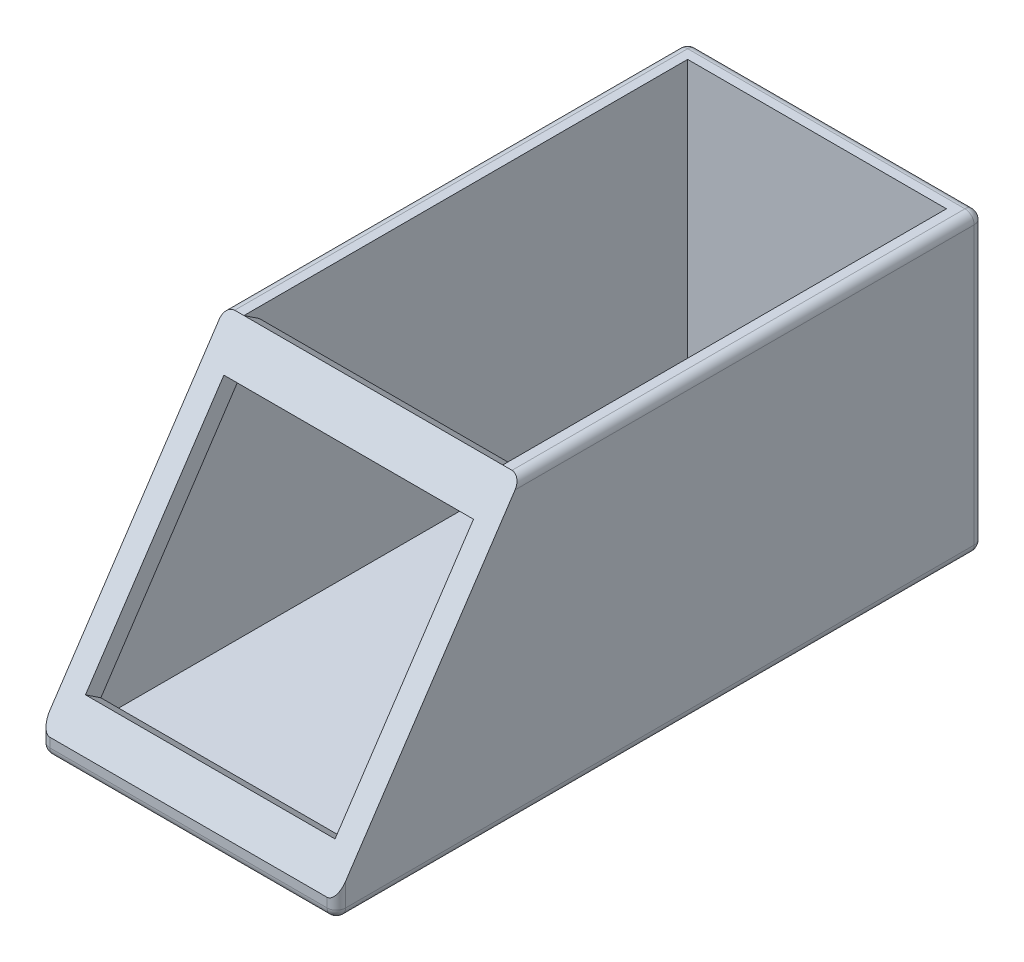
from build123d import *

# Parameters (mm, degrees)
SKETCH2_W           = 32
SKETCH2_H           = 70
BOSS_EXTRUDE1_DEPTH = 2
BOSS_EXTRUDE2_DEPTH = 2
BOSS_EXTRUDE3_DEPTH = 2
SKETCH6_W           = 28
SKETCH6_H           = 30
BOSS_EXTRUDE4_DEPTH = 2
FILLET1_R           = 1
FILLET2_R           = 1
FILLET3_R           = 1
FILLET4_R           = 1
FILLET5_R           = 1
SKETCH7_W           = 28
SKETCH7_H           = 36.055512754
SKETCH7_W_2         = 27
SKETCH7_H_2         = 27
BOSS_EXTRUDE5_DEPTH = 2


with BuildPart() as part:
    # Sketch2 → Boss-Extrude1 (new body)
    with BuildSketch(Plane(origin=(0, 0, 0), x_dir=(1, 0, 0), z_dir=(0, 1, 0))):
        Rectangle(SKETCH2_W, SKETCH2_H)
    extrude(amount=BOSS_EXTRUDE1_DEPTH)



with BuildPart() as body_2:
    # Sketch4 → Boss-Extrude2 (new body)
    with BuildSketch(Plane.ZY.offset(16)):
        Polygon((35, 2), (15, 32), (-35, 32), (-35, 2), align=None)
    extrude(amount=-BOSS_EXTRUDE2_DEPTH)


with BuildPart() as body_3:
    # Sketch5 → Boss-Extrude3 (new body)
    with BuildSketch(Plane(origin=(16, 0, 0), x_dir=(0, 0, -1), z_dir=(1, 0, 0))):
        Polygon((-35, 2), (-15, 32), (35, 32), (35, 2), align=None)
    extrude(amount=-BOSS_EXTRUDE3_DEPTH)


with BuildPart() as part_1:
    add(part.part)

    add(body_2.part)  # Boss-Extrude4 merges body 2

    add(body_3.part)  # Boss-Extrude4 merges body 3
    # Sketch6 → Boss-Extrude4 (add)
    with BuildSketch(Plane(origin=(0, 0, -35), x_dir=(-1, 0, 0), z_dir=(0, 0, -1))):
        with Locations((0, 17)):
            Rectangle(SKETCH6_W, SKETCH6_H)
    extrude(amount=-BOSS_EXTRUDE4_DEPTH)

    # Fillet1
    fillet1_edges = [part_1.edges().sort_by_distance(p)[0] for p in [
        (16, 32, -10),
    ]]
    fillet(fillet1_edges, radius=FILLET1_R)

    # Fillet2
    fillet2_edges = [part_1.edges().sort_by_distance(p)[0] for p in [
        (-16, 32, -10),
    ]]
    fillet(fillet2_edges, radius=FILLET2_R)

    # Fillet3
    fillet3_edges = [part_1.edges().sort_by_distance(p)[0] for p in [
        (0, 32, -35),
        (16, 15.5, -35),
        (15.707106781, 31.707106781, -35),
        (-16, 15.5, -35),
        (-15.707106781, 31.707106781, -35),
    ]]
    fillet(fillet3_edges, radius=FILLET3_R)

    # Fillet4
    fillet4_edges = [part_1.edges().sort_by_distance(p)[0] for p in [
        (0, 0, -35),
        (16, 0, 0.5),
        (-16, 0, 0.5),
        (-15.707106781, 0, -34.707106781),
        (15.707106781, 0, -34.707106781),
    ]]
    fillet(fillet4_edges, radius=FILLET4_R)

    # Fillet5
    fillet5_edges = [part_1.edges().sort_by_distance(p)[0] for p in [
        (16, 1.5, 35),
        (-16, 1.5, 35),
        (0, 0, 35),
        (15.707106781, 0.292893219, 35),
        (-15.707106781, 0.292893219, 35),
    ]]
    fillet(fillet5_edges, radius=FILLET5_R)

    # Sketch7 → Boss-Extrude5 (add)
    with BuildSketch(Plane(origin=(0, 16.769230769, 25.153846154), x_dir=(1, 0, 0), z_dir=(0, 0.5547001962252296, 0.8320502943378435))):
        with Locations((0, 0.277350098)):
            Rectangle(SKETCH7_W, SKETCH7_H)
        Rectangle(SKETCH7_W_2, SKETCH7_H_2, mode=Mode.SUBTRACT)
    extrude(amount=-BOSS_EXTRUDE5_DEPTH)


solid = part_1.part
